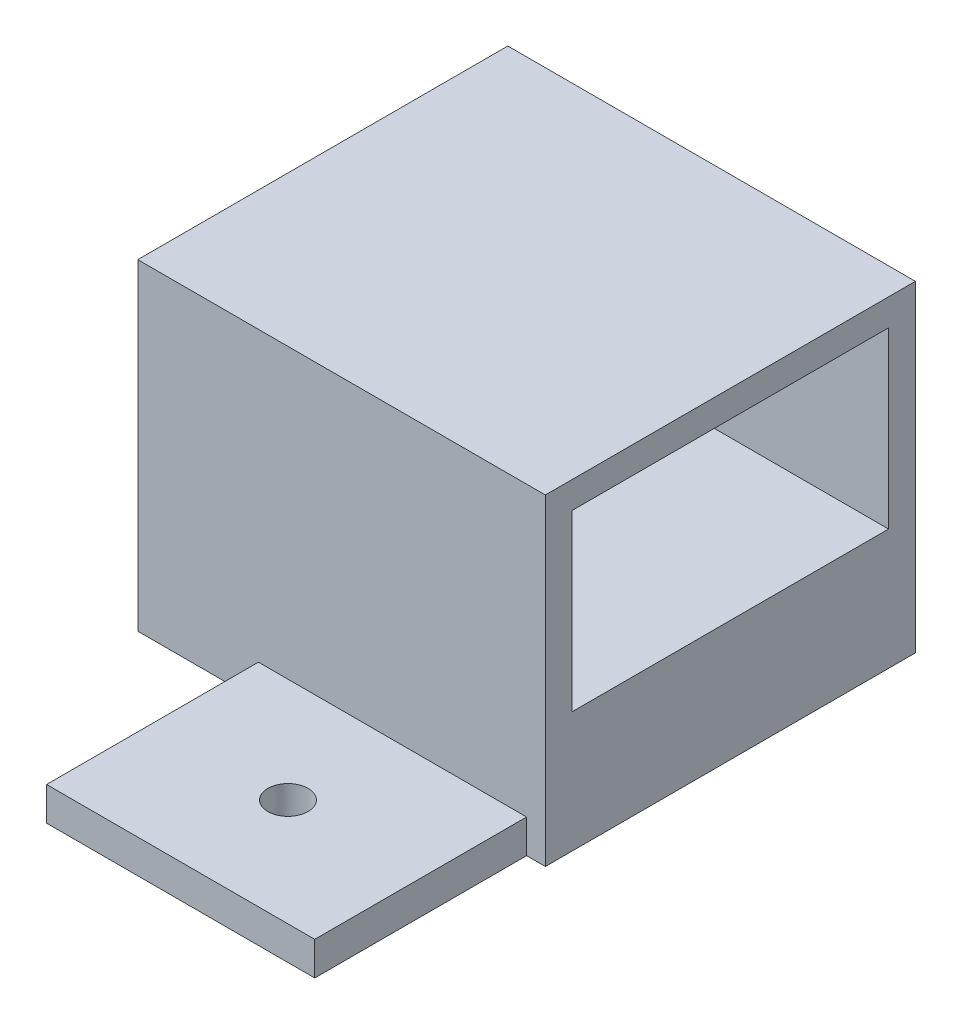
from build123d import *

# Parameters (mm, degrees)
S_BOX1_W       = 20
S_BOX1_H       = 2.5
BOSS_1_DEPTH   = 42
S_BOX2_W       = 30.4
S_BOX2_H       = 24
BOSS_2_DEPTH   = 27.6
S_CUT3_W       = 30.6
S_CUT3_H       = 13
POCKET_3_DEPTH = 23.6
S_CUT4_W       = 23
S_CUT4_H       = 4
POCKET_4_DEPTH = 23.7
S_HOLE5_R      = 1.5
HOLE_5_DEPTH   = 2.7


with BuildPart() as part:
    # S_box1 → Boss_1 (new body)
    with BuildSketch(Plane.XY.offset(-34)):
        with Locations((0, 2.75)):
            Rectangle(S_BOX1_W, S_BOX1_H)
    extrude(amount=BOSS_1_DEPTH)

    # S_box2 → Boss_2 (add)
    with BuildSketch(Plane.XY.offset(-35.4)):
        with Locations((-3.8, 13.5)):
            Rectangle(S_BOX2_W, S_BOX2_H)
    extrude(amount=BOSS_2_DEPTH)

    # S_cut3 → Pocket_3 (cut)
    with BuildSketch(Plane.XY.offset(-33.4)):
        with Locations((-3.8, 17)):
            Rectangle(S_CUT3_W, S_CUT3_H)
    extrude(amount=POCKET_3_DEPTH, mode=Mode.SUBTRACT)

    # S_cut4 → Pocket_4 (cut)
    with BuildSketch(Plane.XY.offset(-35.5)):
        with Locations((-3.5, 6.5)):
            Rectangle(S_CUT4_W, S_CUT4_H)
    extrude(amount=POCKET_4_DEPTH, mode=Mode.SUBTRACT)

    # S_hole5 → Hole_5 (cut)
    with BuildSketch(Plane(origin=(0, 1.4, 0), x_dir=(1, 0, 0), z_dir=(0, 1, 0))):
        with Locations(Location((0, 0, 0), (0, 0, 90))):
            Circle(S_HOLE5_R)
    extrude(amount=HOLE_5_DEPTH, mode=Mode.SUBTRACT)


solid = part.part
